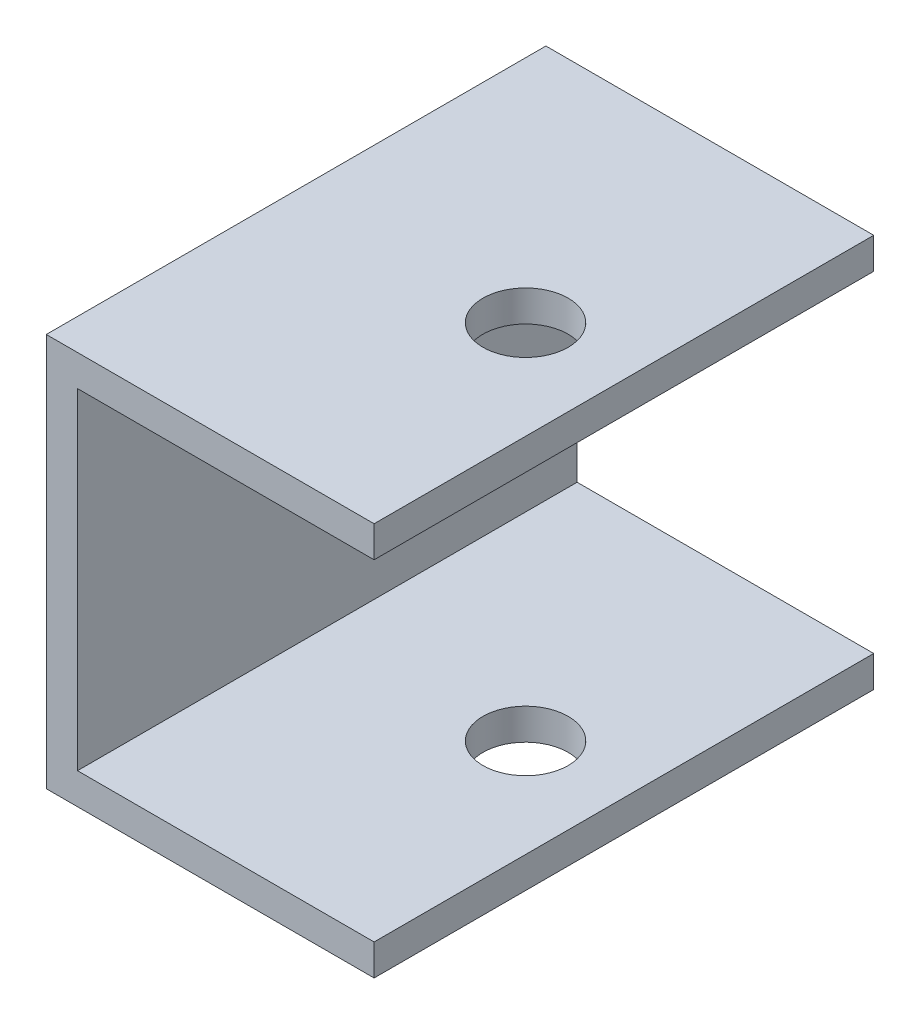
from build123d import *

# Parameters (mm, degrees)
SALIENTE_EXTRUIR3_DEPTH = 38.1
CROQUIS7_R              = 5.55625
CORTAR_EXTRUIR1_DEPTH   = 5
CROQUIS8_R              = 6.5
CORTAR_EXTRUIR2_DEPTH   = 70


with BuildPart() as part:
    # Croquis6 → Saliente-Extruir3 (new, symmetric)
    with BuildSketch(Plane.XY):
        Polygon((45.2375, 25.2375), (0, 25.2375), (0, -25.2375), (45.2375, -25.2375), (45.2375, -30), (-4.7625, -30), (-4.7625, 30), (45.2375, 30), align=None)
    extrude(amount=SALIENTE_EXTRUIR3_DEPTH, both=True)

    # Croquis7 → Cortar-Extruir1 (cut)
    with BuildSketch(Plane.ZY.offset(4.7625)):
        with Locations(Location((0, 0, 0), (0, 0, 270))):
            Circle(CROQUIS7_R)
    extrude(amount=-CORTAR_EXTRUIR1_DEPTH, mode=Mode.SUBTRACT)

    # Croquis8 → Cortar-Extruir2 (cut)
    with BuildSketch(Plane.XZ.offset(30)):
        with Locations((30.2375, 0)):
            Circle(CROQUIS8_R)
    extrude(amount=-CORTAR_EXTRUIR2_DEPTH, mode=Mode.SUBTRACT)


solid = part.part
